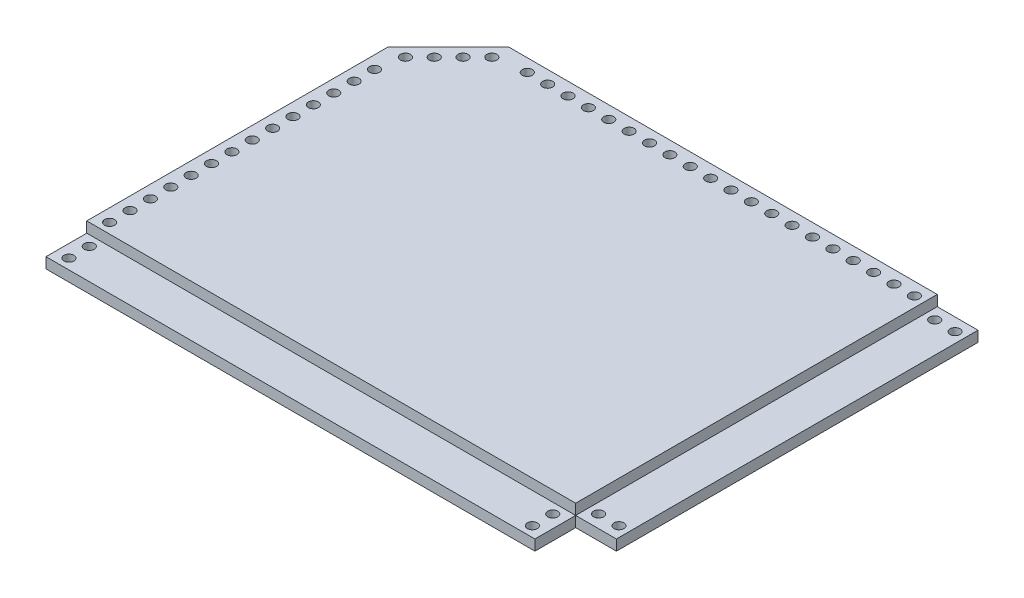
from build123d import *

# Parameters (mm, degrees)
BOSS_EXTRUDE1_DEPTH = 6.35
SKETCH3_R           = 1.5
CUT_EXTRUDE1_DEPTH  = 6.35
LPATTERN2_COUNT     = 22
LPATTERN2_PITCH     = 6.096
SKETCH4_R           = 1.5
CUT_EXTRUDE2_DEPTH  = 6.35
LPATTERN3_COUNT     = 16
LPATTERN3_PITCH     = 6.096
SKETCH6_W           = 120.396
SKETCH6_H           = 3.175
CUT_EXTRUDE3_DEPTH  = 12.192
SKETCH7_W           = 146.304
SKETCH7_H           = 3.175
CUT_EXTRUDE4_DEPTH  = 12.192
SKETCH8_W           = 12.192
SKETCH8_H           = 12.192
CUT_EXTRUDE5_DEPTH  = 6.35
SKETCH9_R           = 1.5
CUT_EXTRUDE6_DEPTH  = 6.35
SKETCH10_R          = 1.5
CUT_EXTRUDE7_DEPTH  = 6.35


with BuildPart() as part:
    # Sketch2 → Boss-Extrude1 (new body)
    with BuildSketch(Plane(origin=(0, 0, 0), x_dir=(1, 0, 0), z_dir=(0, 1, 0))):
        Polygon((-55.206688966, 44.945004491), (-73.167201208, 26.984492248), (-73.167201208, -75.450995509), (85.328798792, -75.450995509), (85.328798792, 44.945004491), align=None)
    extrude(amount=BOSS_EXTRUDE1_DEPTH)

    # Sketch3 → Cut-Extrude1 (cut)
    with BuildSketch(Plane(origin=(0, 6.35, 0), x_dir=(1, 0, 0), z_dir=(0, 1, 0))):
        with Locations(Location((82.280798792, 41.135004491, 0), (0, 0, 270))):
            Circle(SKETCH3_R)
    cut_extrude1 = extrude(amount=-CUT_EXTRUDE1_DEPTH, mode=Mode.SUBTRACT)

    # LPattern2: Cut-Extrude1 ×22
    with Locations(*[(-i * LPATTERN2_PITCH, 0, 0) for i in range(1, LPATTERN2_COUNT)]):
        add(cut_extrude1, mode=Mode.SUBTRACT)

    # Sketch4 → Cut-Extrude2 (cut)
    with BuildSketch(Plane(origin=(0, 6.35, 0), x_dir=(1, 0, 0), z_dir=(0, 1, 0))):
        with Locations(Location((-69.357201208, -72.402995509, 0), (0, 0, 270))):
            Circle(SKETCH4_R)
    cut_extrude2 = extrude(amount=-CUT_EXTRUDE2_DEPTH, mode=Mode.SUBTRACT)

    # LPattern3: Cut-Extrude2 ×16
    with Locations(*[(0, 0, -i * LPATTERN3_PITCH) for i in range(1, LPATTERN3_COUNT)]):
        add(cut_extrude2, mode=Mode.SUBTRACT)

    # Sketch6 → Cut-Extrude3 (cut)
    with BuildSketch(Plane(origin=(85.328798792, 0, 0), x_dir=(0, 0, -1), z_dir=(1, 0, 0))):
        with Locations((-15.252995509, 4.7625)):
            Rectangle(SKETCH6_W, SKETCH6_H)
    extrude(amount=-CUT_EXTRUDE3_DEPTH, mode=Mode.SUBTRACT)

    # Sketch7 → Cut-Extrude4 (cut)
    with BuildSketch(Plane.XY.offset(75.450995509)):
        with Locations((-0.015201208, 4.7625)):
            Rectangle(SKETCH7_W, SKETCH7_H)
    extrude(amount=-CUT_EXTRUDE4_DEPTH, mode=Mode.SUBTRACT)

    # Sketch8 → Cut-Extrude5 (cut)
    with BuildSketch(Plane(origin=(0, 3.175, 0), x_dir=(1, 0, 0), z_dir=(0, 1, 0))):
        with Locations((79.232798792, -69.354995509)):
            Rectangle(SKETCH8_W, SKETCH8_H)
    extrude(amount=-CUT_EXTRUDE5_DEPTH, mode=Mode.SUBTRACT)

    # Sketch9 → Cut-Extrude6 (cut)
    with BuildSketch(Plane(origin=(0, 3.175, 0), x_dir=(1, 0, 0), z_dir=(0, 1, 0))):
        with Locations(Location((69.326798792, -66.306995509, 0), (0, 0, 270))):
            Circle(SKETCH9_R)
        with Locations(Location((69.326798792, -72.402995509, 0), (0, 0, 270))):
            Circle(SKETCH9_R)
        with Locations(Location((76.184798792, -59.448995509, 0), (0, 0, 270))):
            Circle(SKETCH9_R)
        with Locations(Location((82.280798792, -59.448995509, 0), (0, 0, 270))):
            Circle(SKETCH9_R)
    extrude(amount=-CUT_EXTRUDE6_DEPTH, mode=Mode.SUBTRACT)

    # Sketch10 → Cut-Extrude7 (cut)
    with BuildSketch(Plane(origin=(0, 6.35, 0), x_dir=(1, 0, 0), z_dir=(0, 1, 0))):
        with Locations(Location((-59.294699493, 35.46884029, 0), (0, 0, 270))):
            Circle(SKETCH10_R)
        with Locations(Location((-63.605762233, 31.157777551, 0), (0, 0, 270))):
            Circle(SKETCH10_R)
        with Locations(Location((-54.984176555, 39.779363228, 0), (0, 0, 270))):
            Circle(SKETCH10_R)
        with Locations(Location((-67.916285171, 26.847254613, 0), (0, 0, 270))):
            Circle(SKETCH10_R)
    extrude(amount=-CUT_EXTRUDE7_DEPTH, mode=Mode.SUBTRACT)


solid = part.part
